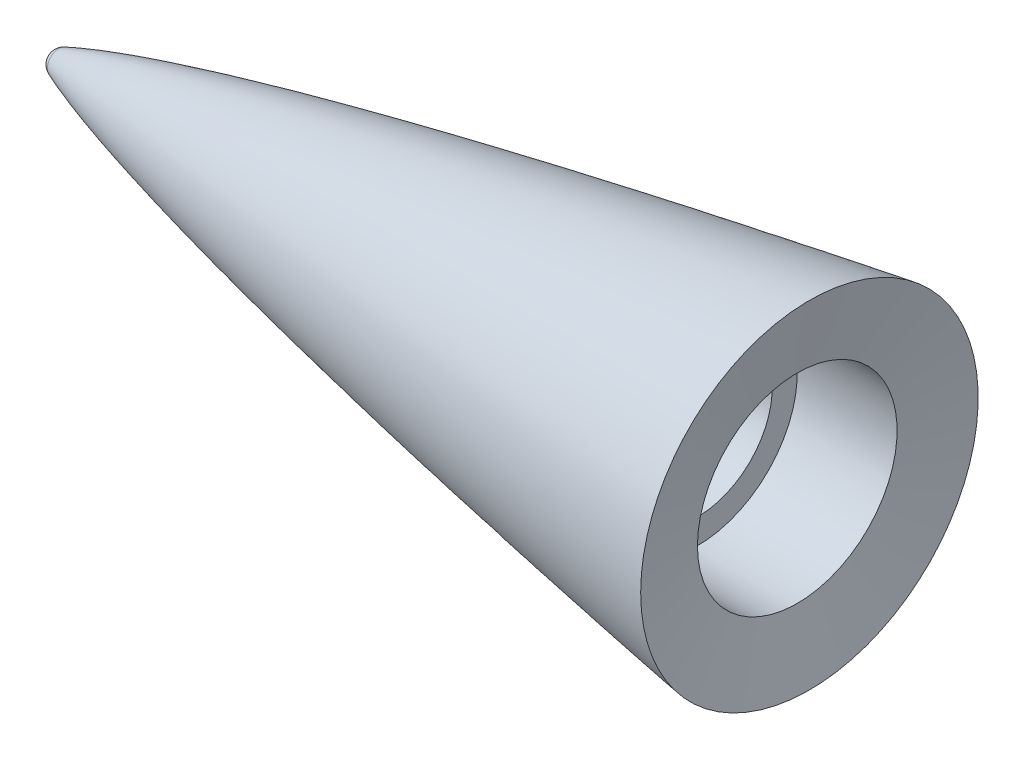
from build123d import *


with BuildPart() as part:
    # Sketch1 → Revolve2 (revolve)
    with BuildSketch(Plane(origin=(0, 0, 0), x_dir=(1, 0, 0), z_dir=(0, 1, 0)), mode=Mode.PRIVATE) as revolve2_sk:
        with BuildLine():
            Line((1.697321091, 0), (39.469405392, 0))
            Line((39.469405392, 0), (39.469405392, 6.35))
            Line((39.469405392, 6.35), (58.519405392, 6.35))
            Line((58.519405392, 6.35), (58.519405392, 9.525))
            Line((58.519405392, 9.525), (83.919405392, 9.525))
            Line((83.919405392, 9.525), (83.919405392, 12.7))
            Line((83.919405392, 12.7), (96.619405392, 12.7))
            Line((96.619405392, 12.7), (98.165428581, 21.4679332))
            add(Edge.make_bspline(
                [(2.682127148, 1.468644362), (2.982092127, 1.591742283), (3.982765764, 1.986976913), (6.075542743, 2.735585346), (9.959285205, 3.961402854), (15.35260807, 5.458934046), (21.847317263, 7.086678944), (29.055363889, 8.749177841), (36.286920774, 10.313744718), (43.531901048, 11.801111844), (50.793776988, 13.226984496), (58.058153921, 14.599266319), (64.433980883, 15.762645369), (69.883896781, 16.732062359), (74.459068804, 17.529825957), (78.065425347, 18.150661812), (81.784961377, 18.781283529), (85.307065103, 19.372441088), (89.168740248, 20.010357493), (92.45838759, 20.54964543), (95.664328261, 21.067043036), (97.333372349, 21.334925019), (98.164963492, 21.467858845), (98.165428581, 21.4679332)],
                knots=[0.027847292, 0.027847292, 0.027847292, 0.027847292, 0.027847292, 0.039565322, 0.06672611, 0.108155752, 0.174993972, 0.2418322, 0.308670423, 0.375508647, 0.442346873, 0.509185099, 0.576023325, 0.642861549, 0.676280662, 0.709699776, 0.743118888, 0.776538001, 0.809957114, 0.843376227, 0.87679534, 0.910214452, 0.910233153, 0.910233153, 0.910233153, 0.910233153, 0.910233153], degree=4))
            ThreePointArc((2.682127148, 1.468644362), (1.966311917, 0.884132234), (1.697321091, 0))
        make_face()
    revolve(revolve2_sk.sketch.rotate(Axis((0, 0, 0), (1, 0, 0)), 180), axis=Axis((0, 0, 0), (1, 0, 0)))


solid = part.part
